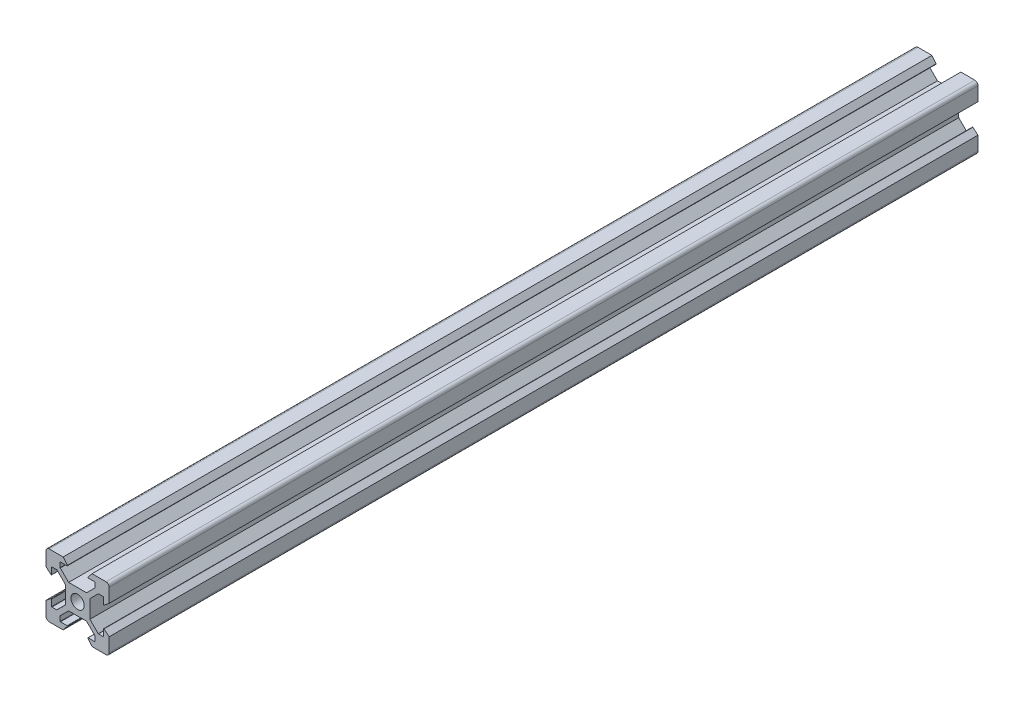
from build123d import *

# Parameters (mm, degrees)
SKETCH1_R           = 2.1
BOSS_EXTRUDE1_DEPTH = 275
FILLET1_R           = 1


with BuildPart() as part:
    # Sketch1 → Boss-Extrude1 (new body)
    with BuildSketch(Plane.XY):
        with BuildLine():
            Line((-2.839339828, 3.9), (-5.470710678, 6.53137085))
            ThreePointArc((-5.470710678, 6.53137085), (-5.492387953, 6.563813185), (-5.5, 6.602081528))
            Line((-5.5, 6.602081528), (-5.5, 8.1))
            ThreePointArc((-5.5, 8.1), (-5.470710678, 8.170710678), (-5.4, 8.2))
            Line((-5.4, 8.2), (-3.334418044, 8.2))
            ThreePointArc((-3.334418044, 8.2), (-3.244178397, 8.256909326), (-3.2566483, 8.362863876))
            Line((-3.2566483, 8.362863876), (-4.58, 10))
            Line((-4.58, 10), (-10, 10))
            Line((-10, 10), (-10, 4.58))
            Line((-10, 4.58), (-8.362863876, 3.2566483))
            ThreePointArc((-8.362863876, 3.2566483), (-8.256909326, 3.244178397), (-8.2, 3.334418044))
            Line((-8.2, 3.334418044), (-8.2, 5.4))
            ThreePointArc((-8.2, 5.4), (-8.170710678, 5.470710678), (-8.1, 5.5))
            Line((-8.1, 5.5), (-6.602081528, 5.5))
            ThreePointArc((-6.602081528, 5.5), (-6.563813185, 5.492387953), (-6.53137085, 5.470710678))
            Line((-6.53137085, 5.470710678), (-3.9, 2.839339828))
            Line((-3.9, 2.839339828), (-3.9, -2.839339828))
            Line((-3.9, -2.839339828), (-6.53137085, -5.470710678))
            ThreePointArc((-6.53137085, -5.470710678), (-6.563813185, -5.492387953), (-6.602081528, -5.5))
            Line((-6.602081528, -5.5), (-8.1, -5.5))
            ThreePointArc((-8.1, -5.5), (-8.170710678, -5.470710678), (-8.2, -5.4))
            Line((-8.2, -5.4), (-8.2, -3.334418044))
            ThreePointArc((-8.2, -3.334418044), (-8.256909326, -3.244178397), (-8.362863876, -3.2566483))
            Line((-8.362863876, -3.2566483), (-10, -4.58))
            Line((-10, -4.58), (-10, -10))
            Line((-10, -10), (-4.58, -10))
            Line((-4.58, -10), (-3.2566483, -8.362863876))
            ThreePointArc((-3.2566483, -8.362863876), (-3.244178397, -8.256909326), (-3.334418044, -8.2))
            Line((-3.334418044, -8.2), (-5.4, -8.2))
            ThreePointArc((-5.4, -8.2), (-5.470710678, -8.170710678), (-5.5, -8.1))
            Line((-5.5, -8.1), (-5.5, -6.602081528))
            ThreePointArc((-5.5, -6.602081528), (-5.492387953, -6.563813185), (-5.470710678, -6.53137085))
            Line((-5.470710678, -6.53137085), (-2.839339828, -3.9))
            Line((-2.839339828, -3.9), (2.839339828, -3.9))
            Line((2.839339828, -3.9), (5.470710678, -6.53137085))
            ThreePointArc((5.470710678, -6.53137085), (5.492387953, -6.563813185), (5.5, -6.602081528))
            Line((5.5, -6.602081528), (5.5, -8.1))
            ThreePointArc((5.5, -8.1), (5.470710678, -8.170710678), (5.4, -8.2))
            Line((5.4, -8.2), (3.334418044, -8.2))
            ThreePointArc((3.334418044, -8.2), (3.244178397, -8.256909326), (3.2566483, -8.362863876))
            Line((3.2566483, -8.362863876), (4.58, -10))
            Line((4.58, -10), (10, -10))
            Line((10, -10), (10, -4.58))
            Line((10, -4.58), (8.362863876, -3.2566483))
            ThreePointArc((8.362863876, -3.2566483), (8.256909326, -3.244178397), (8.2, -3.334418044))
            Line((8.2, -3.334418044), (8.2, -5.4))
            ThreePointArc((8.2, -5.4), (8.170710678, -5.470710678), (8.1, -5.5))
            Line((8.1, -5.5), (6.602081528, -5.5))
            ThreePointArc((6.602081528, -5.5), (6.563813185, -5.492387953), (6.53137085, -5.470710678))
            Line((6.53137085, -5.470710678), (3.9, -2.839339828))
            Line((3.9, -2.839339828), (3.9, 2.839339828))
            Line((3.9, 2.839339828), (6.53137085, 5.470710678))
            ThreePointArc((6.53137085, 5.470710678), (6.563813185, 5.492387953), (6.602081528, 5.5))
            Line((6.602081528, 5.5), (8.1, 5.5))
            ThreePointArc((8.1, 5.5), (8.170710678, 5.470710678), (8.2, 5.4))
            Line((8.2, 5.4), (8.2, 3.334418044))
            ThreePointArc((8.2, 3.334418044), (8.256909326, 3.244178397), (8.362863876, 3.2566483))
            Line((8.362863876, 3.2566483), (10, 4.58))
            Line((10, 4.58), (10, 10))
            Line((10, 10), (4.58, 10))
            Line((4.58, 10), (3.2566483, 8.362863876))
            ThreePointArc((3.2566483, 8.362863876), (3.244178397, 8.256909326), (3.334418044, 8.2))
            Line((3.334418044, 8.2), (5.4, 8.2))
            ThreePointArc((5.4, 8.2), (5.470710678, 8.170710678), (5.5, 8.1))
            Line((5.5, 8.1), (5.5, 6.602081528))
            ThreePointArc((5.5, 6.602081528), (5.492387953, 6.563813185), (5.470710678, 6.53137085))
            Line((5.470710678, 6.53137085), (2.839339828, 3.9))
            Line((2.839339828, 3.9), (-2.839339828, 3.9))
        make_face()
        Circle(SKETCH1_R, mode=Mode.SUBTRACT)
    extrude(amount=BOSS_EXTRUDE1_DEPTH)

    # Fillet1
    fillet1_edges = [part.edges().sort_by_distance(p)[0] for p in [
        (10, -10, 137.5),
        (-10, -10, 137.5),
        (-10, 10, 137.5),
        (10, 10, 137.5),
    ]]
    fillet(fillet1_edges, radius=FILLET1_R)


solid = part.part
